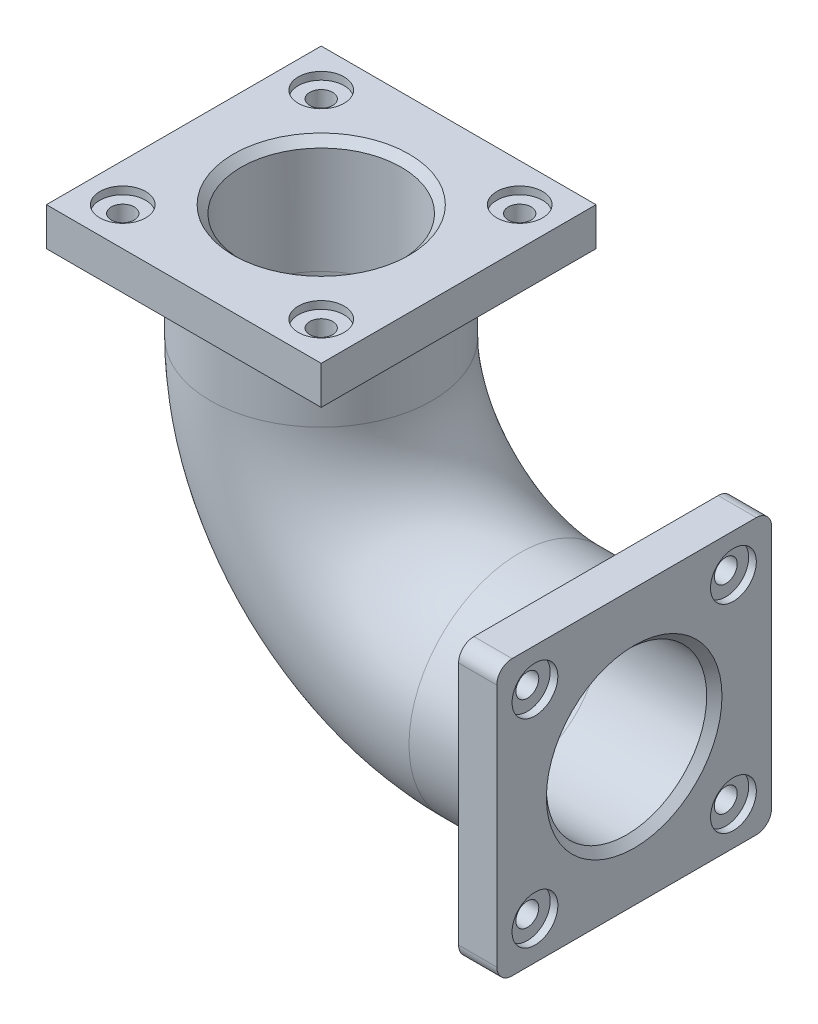
from build123d import *

# Parameters (mm, degrees)
SKETCH2_R           = 145
SKETCH2_R_2         = 105
BOSS_EXTRUDE1_START = -50
SKETCH4_W           = 360
SKETCH4_H           = 360
SKETCH4_R           = 145
BOSS_EXTRUDE1_DEPTH = 50
CUT_EXTRUDE1_DEPTH  = 10
CUT_EXTRUDE2_REACH  = 707.355
SKETCH6_R           = 15
CIRPATTERN1_COUNT   = 4
FILLET1_R           = 20
FILLET2_R           = 10
CHAMFER1_SIZE       = 10
SKETCH7_W           = 360
SKETCH7_H           = 360
SKETCH7_R           = 145
BOSS_EXTRUDE2_DEPTH = 50
CUT_EXTRUDE3_DEPTH  = 10
CUT_EXTRUDE4_REACH  = 848.699
SKETCH9_R           = 15
CIRPATTERN3_COUNT   = 4
CHAMFER2_SIZE       = 10
FILLET4_R           = 10


with BuildPart() as part:
    # Sweep-Thin1: sweep along a path in Sketch1
    with BuildLine(Plane.XY) as sweep_thin1_path:
        Line((0, 0), (-150, 0))
        ThreePointArc((-150, 0), (-333.847763109, 76.152236891), (-410, 260))
        Line((-410, 260), (-410, 410))
    # Sketch2 → Sweep-Thin1 (sweep)
    with BuildSketch(Plane(origin=(0, 0, 0), x_dir=(0, 0, -1), z_dir=(1, 0, 0))):
        Circle(SKETCH2_R)
        Circle(SKETCH2_R_2, mode=Mode.SUBTRACT)
    sweep(path=sweep_thin1_path.line)

    # Sketch4 → Boss-Extrude1 (add)
    with BuildSketch(Plane(origin=(0, 0, 0), x_dir=(0, 0, -1), z_dir=(1, 0, 0)).offset(BOSS_EXTRUDE1_START)):
        Rectangle(SKETCH4_W, SKETCH4_H)
        with Locations(Location((0, 0, 0), (0, 0, 270))):
            Circle(SKETCH4_R, mode=Mode.SUBTRACT)
    extrude(amount=BOSS_EXTRUDE1_DEPTH)

    # Sketch5 → Cut-Extrude1 (cut)
    with BuildSketch(Plane(origin=(0, 0, 0), x_dir=(0, 0, -1), z_dir=(1, 0, 0))):
        with BuildLine():
            Line((-130, 100), (-130, 130))
            Line((-130, 130), (-100, 130))
            ThreePointArc((-100, 130), (-151.213203436, 151.213203436), (-130, 100))
        make_face()
        with BuildLine():
            Line((-100, 130), (-130, 130))
            Line((-130, 130), (-130, 100))
            ThreePointArc((-130, 100), (-108.786796564, 108.786796564), (-100, 130))
        make_face()
    cut_extrude1 = extrude(amount=-CUT_EXTRUDE1_DEPTH, mode=Mode.SUBTRACT)

    # Sketch6 → Cut-Extrude2 (cut, up to next)
    with BuildSketch(Plane(origin=(-10, 0, 0), x_dir=(0, 0, -1), z_dir=(1, 0, 0)), mode=Mode.PRIVATE) as cut_extrude2_sk1:
        with Locations((-130, 130)):
            Circle(SKETCH6_R)
    cut_extrude2_tool1 = extrude(cut_extrude2_sk1.sketch, amount=-CUT_EXTRUDE2_REACH, mode=Mode.PRIVATE) & part.part
    cut_extrude2 = cut_extrude2_tool1.solids().sort_by_distance((-10, 130, 130))[0]
    add(cut_extrude2, mode=Mode.SUBTRACT)

    # CirPattern1: Cut-Extrude1, Cut-Extrude2 ×4 about axis
    cirpattern1_axis = Axis((0, 0, 0), (1, 0, 0))
    add([cut_extrude1.rotate(cirpattern1_axis, i * 360 / CIRPATTERN1_COUNT) for i in range(1, CIRPATTERN1_COUNT)], mode=Mode.SUBTRACT)
    add([cut_extrude2.rotate(cirpattern1_axis, i * 360 / CIRPATTERN1_COUNT) for i in range(1, CIRPATTERN1_COUNT)], mode=Mode.SUBTRACT)

    # Fillet1
    fillet1_edges = [part.edges().sort_by_distance(p)[0] for p in [
        (-25, 180, -180),
        (-25, -180, -180),
        (-25, -180, 180),
        (-25, 180, 180),
    ]]
    fillet(fillet1_edges, radius=FILLET1_R)

    # Fillet2
    fillet2_edges = [part.edges().sort_by_distance(p)[0] for p in [
        (-50, 0, 145),
    ]]
    fillet(fillet2_edges, radius=FILLET2_R)

    # Chamfer1
    chamfer1_edges = [part.edges().sort_by_distance(p)[0] for p in [
        (0, 0, 105),
    ]]
    chamfer(chamfer1_edges, length=CHAMFER1_SIZE)

    # Sketch7 → Boss-Extrude2 (add)
    with BuildSketch(Plane(origin=(0, 410, 0), x_dir=(1, 0, 0), z_dir=(0, 1, 0))):
        with Locations((-410, 0)):
            Rectangle(SKETCH7_W, SKETCH7_H)
        with Locations(Location((-410, 0, 0), (0, 0, 270))):
            Circle(SKETCH7_R, mode=Mode.SUBTRACT)
    extrude(amount=-BOSS_EXTRUDE2_DEPTH)

    # Sketch8 → Cut-Extrude3 (cut)
    with BuildSketch(Plane(origin=(0, 410, 0), x_dir=(1, 0, 0), z_dir=(0, 1, 0))):
        with BuildLine():
            Line((-540, 100), (-540, 130))
            Line((-540, 130), (-510, 130))
            ThreePointArc((-510, 130), (-561.213203436, 151.213203436), (-540, 100))
        make_face()
        with BuildLine():
            Line((-510, 130), (-540, 130))
            Line((-540, 130), (-540, 100))
            ThreePointArc((-540, 100), (-518.786796564, 108.786796564), (-510, 130))
        make_face()
    cut_extrude3 = extrude(amount=-CUT_EXTRUDE3_DEPTH, mode=Mode.SUBTRACT)

    # Sketch9 → Cut-Extrude4 (cut, up to next)
    with BuildSketch(Plane(origin=(0, 400, 0), x_dir=(1, 0, 0), z_dir=(0, 1, 0)), mode=Mode.PRIVATE) as cut_extrude4_sk1:
        with Locations(Location((-540, 130, 0), (0, 0, 270))):
            Circle(SKETCH9_R)
    cut_extrude4_tool1 = extrude(cut_extrude4_sk1.sketch, amount=-CUT_EXTRUDE4_REACH, mode=Mode.PRIVATE) & part.part
    cut_extrude4 = cut_extrude4_tool1.solids().sort_by_distance((-540, 400, -130))[0]
    add(cut_extrude4, mode=Mode.SUBTRACT)

    # CirPattern3: Cut-Extrude3, Cut-Extrude4 ×4 about axis
    cirpattern3_axis = Axis((-410, 0, 0), (0, 1, 0))
    add([cut_extrude3.rotate(cirpattern3_axis, i * 360 / CIRPATTERN3_COUNT) for i in range(1, CIRPATTERN3_COUNT)], mode=Mode.SUBTRACT)
    add([cut_extrude4.rotate(cirpattern3_axis, i * 360 / CIRPATTERN3_COUNT) for i in range(1, CIRPATTERN3_COUNT)], mode=Mode.SUBTRACT)

    # Chamfer2
    chamfer2_edges = [part.edges().sort_by_distance(p)[0] for p in [
        (-410, 410, 105),
    ]]
    chamfer(chamfer2_edges, length=CHAMFER2_SIZE)

    # Fillet4
    fillet4_edges = [part.edges().sort_by_distance(p)[0] for p in [
        (-410, 360, 145),
    ]]
    fillet(fillet4_edges, radius=FILLET4_R)


solid = part.part
